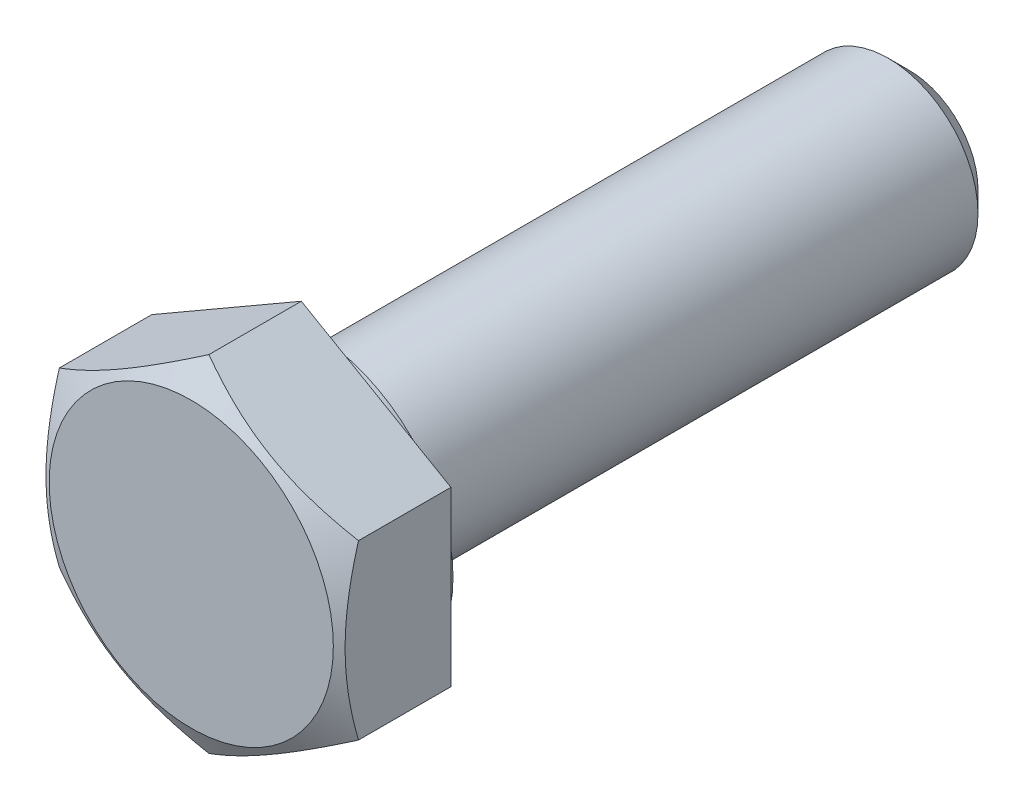
from build123d import *

# Parameters (mm, degrees)
SKETCH4_OUTSIDE_W  = 19.354
SKETCH4_OUTSIDE_H  = 19.354
CUT_EXTRUDE1_DEPTH = 26.350871122


with BuildPart() as part:
    # Sketch3 → Revolve1 (revolve)
    with BuildSketch(Plane(origin=(0, 0, 0), x_dir=(0, 0, -1), z_dir=(1, 0, 0))):
        Polygon((-12, 0), (-12, 4.75), (-11.409080445, 5.773502692), (-8.32, 5.773502692), (-8.32, 4.75), (-8, 4.75), (-8, 3), (11.3, 3), (12, 2.3), (12, 0), align=None)
    revolve(axis=Axis((0, 0, 12), (0, 0, -1)))

    # Sketch4 outside → Cut-Extrude1 (cut, through all)
    with BuildSketch(Plane.XY.offset(12)):
        Rectangle(SKETCH4_OUTSIDE_W, SKETCH4_OUTSIDE_H)
        Polygon((5, 2.886751346), (0, 5.773502692), (-5, 2.886751346), (-5, -2.886751346), (0, -5.773502692), (5, -2.886751346), align=None, mode=Mode.SUBTRACT)
    extrude(amount=-CUT_EXTRUDE1_DEPTH, mode=Mode.SUBTRACT)


solid = part.part
